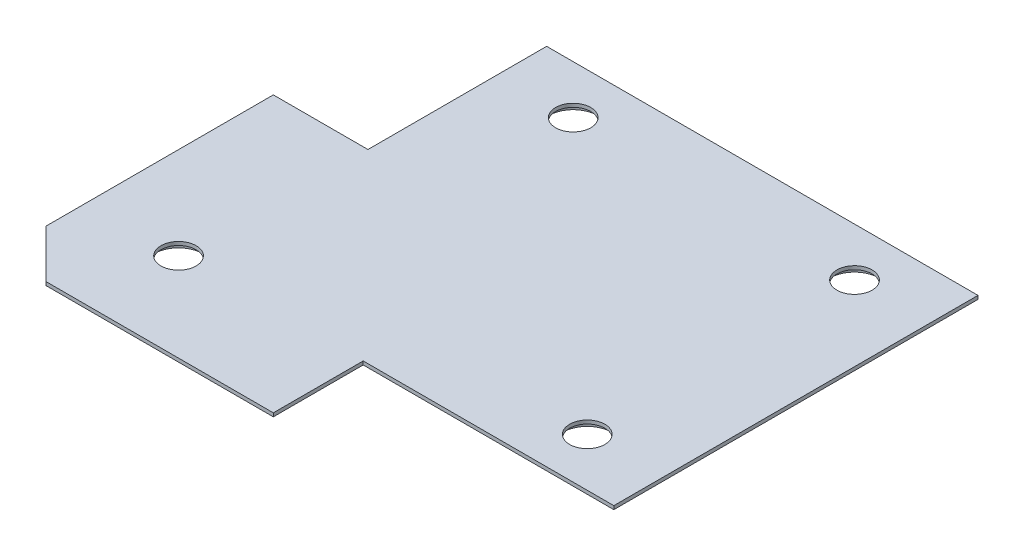
from build123d import *

# Parameters (mm, degrees)
BOSS_EXTRUDE1_DEPTH = 2
CHAMFER1_SIZE       = 8
BOSS_EXTRUDE2_DEPTH = 1.5
SKETCH4_W           = 99.768826376
SKETCH4_H           = 91.588754032
CUT_EXTRUDE1_DEPTH  = 2
SKETCH5_R           = 2.5
CUT_EXTRUDE2_DEPTH  = 2
SKETCH6_R           = 3.5
CUT_EXTRUDE3_DEPTH  = 1
CHAMFER2_SIZE       = 1


with BuildPart() as part:
    # Sketch1 → Boss-Extrude1 (new body)
    with BuildSketch(Plane(origin=(0, 0, 0), x_dir=(1, 0, 0), z_dir=(0, 1, 0))):
        Polygon((-1.782487159, -28.34466675), (33.85093234, -28.34466675), (33.85093234, 27.435918205), (-31.480603593, 27.435918205), (-31.480603593, 2.026433414), (-44.933505709, 2.026433414), (-44.933505709, -41.124585136), (-1.782487159, -41.124585136), align=None)
    extrude(amount=BOSS_EXTRUDE1_DEPTH)

    # Chamfer1
    chamfer1_edges = [part.edges().sort_by_distance(p)[0] for p in [
        (-44.933505709, 1, 41.124585136),
    ]]
    chamfer(chamfer1_edges, length=CHAMFER1_SIZE)

    # Sketch3 → Boss-Extrude2 (add)
    with BuildSketch(Plane(origin=(0, 2, 0), x_dir=(1, 0, 0), z_dir=(0, 1, 0))):
        Polygon((-29.480603593, 25.435918205), (31.85093234, 25.435918205), (31.85093234, -26.34466675), (-3.782487159, -26.34466675), (-3.782487159, -39.124585136), (-36.105078585, -39.124585136), (-42.933505709, -32.296158012), (-42.933505709, 0.026433414), (-29.480603593, 0.026433414), align=None)
    extrude(amount=BOSS_EXTRUDE2_DEPTH)

    # Sketch4 → Cut-Extrude1 (cut)
    with BuildSketch(Plane.XZ):
        Rectangle(SKETCH4_W, SKETCH4_H)
    extrude(amount=-CUT_EXTRUDE1_DEPTH, mode=Mode.SUBTRACT)

    # Sketch5 → Cut-Extrude2 (cut)
    with BuildSketch(Plane(origin=(0, 3.5, 0), x_dir=(1, 0, 0), z_dir=(0, 1, 0))):
        with Locations(Location((-18.814835626, 18.545625727, 0), (0, 0, 270))):
            Circle(SKETCH5_R)
        with Locations(Location((21.185164374, 18.545625727, 0), (0, 0, 270))):
            Circle(SKETCH5_R)
        with Locations(Location((21.185164374, -19.454374273, 0), (0, 0, 270))):
            Circle(SKETCH5_R)
        with Locations(Location((-29.854835626, -26.529137879, 0), (0, 0, 270))):
            Circle(SKETCH5_R)
    extrude(amount=-CUT_EXTRUDE2_DEPTH, mode=Mode.SUBTRACT)

    # Sketch6 → Cut-Extrude3 (cut)
    with BuildSketch(Plane.XZ.offset(-2)):
        with Locations(Location((-29.854835626, 26.529137879, 0), (0, 0, 270))):
            Circle(SKETCH6_R)
        with Locations(Location((21.185164374, 19.454374273, 0), (0, 0, 270))):
            Circle(SKETCH6_R)
        with Locations(Location((-18.814835626, -18.545625727, 0), (0, 0, 270))):
            Circle(SKETCH6_R)
        with Locations(Location((21.185164374, -18.545625727, 0), (0, 0, 270))):
            Circle(SKETCH6_R)
    extrude(amount=-CUT_EXTRUDE3_DEPTH, mode=Mode.SUBTRACT)

    # Chamfer2
    chamfer2_edges = [part.edges().sort_by_distance(p)[0] for p in [
        (-29.480603593, 2, -12.731175809),
        (-36.207054651, 2, -0.026433414),
        (-42.933505709, 2, 16.134862299),
        (-39.519292147, 2, 35.710371574),
        (-19.943782872, 2, 39.124585136),
        (-3.782487159, 2, 32.734625943),
        (14.034222591, 2, 26.34466675),
        (31.85093234, 2, 0.454374273),
        (1.185164374, 2, -25.435918205),
    ]]
    chamfer(chamfer2_edges, length=CHAMFER2_SIZE)


solid = part.part
